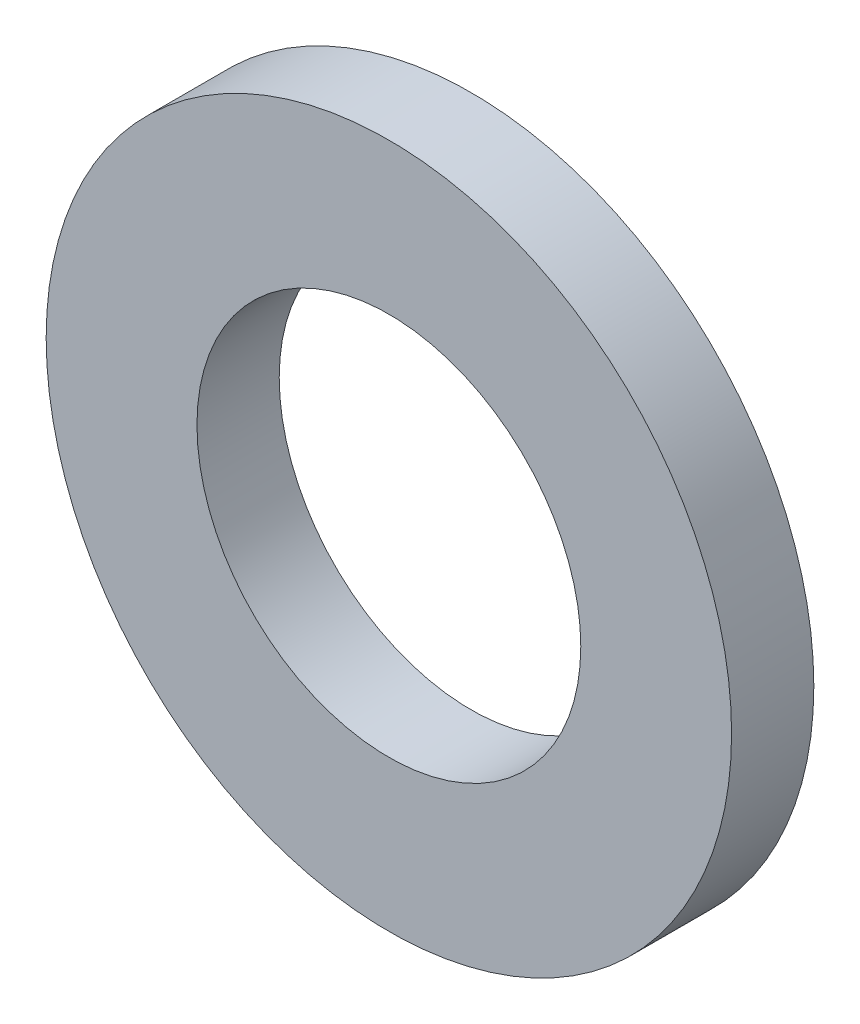
from build123d import *

# Parameters (mm, degrees)
SKETCH1_R           = 7.5
SKETCH1_R_2         = 4.2
BOSS_EXTRUDE1_DEPTH = 1.8


with BuildPart() as part:
    # Sketch1 → Boss-Extrude1 (new body)
    with BuildSketch(Plane.XY):
        with Locations(Location((0, 0, 0), (0, 0, 180))):
            Circle(SKETCH1_R)
        with Locations(Location((0, 0, 0), (0, 0, 180))):
            Circle(SKETCH1_R_2, mode=Mode.SUBTRACT)
    extrude(amount=BOSS_EXTRUDE1_DEPTH)


solid = part.part
